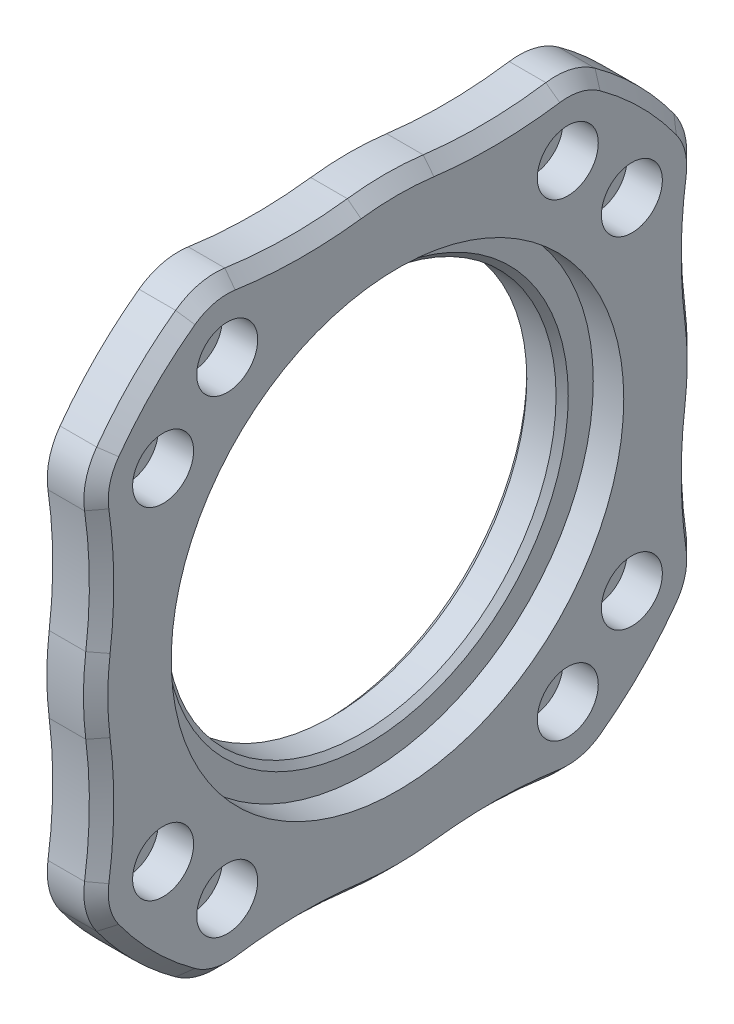
from build123d import *

# Parameters (mm, degrees)
SKETCH_1_R                     = 30
EXTRUDE_1_DEPTH                = 4
EXTRUDE_2_DEPTH                = 1.9
CHAMFER_1_SIZE                 = 1
SKETCH_5_R                     = 16
CUT_EXTRUDE_2_DEPTH            = 43.83468221
HOLE_WIZARD_M2_5_1_D           = 2.7
HOLE_WIZARD_M2_5_1_CBORE_D     = 5
HOLE_WIZARD_M2_5_1_CBORE_DEPTH = 2.9
SKETCH_8_OUTSIDE_W             = 79.012
SKETCH_8_OUTSIDE_H             = 79.012
CUT_EXTRUDE_3_DEPTH            = 43.83468221
CHAMFER_2_SIZE                 = 1
SKETCH_9_R                     = 18.55
CUT_EXTRUDE_4_DEPTH            = 2.5
CHAMFER_3_SIZE                 = 0.5


with BuildPart() as part:
    # 草图1 → 凸台-拉伸1 (new body)
    with BuildSketch(Plane.YZ):
        with Locations(Location((0, 0, 0), (0, 0, 270))):
            Circle(SKETCH_1_R)
    extrude(amount=EXTRUDE_1_DEPTH)

    # 草图2 → 凸台-拉伸2 (add)
    with BuildSketch(Plane(origin=(0, 0, 0), x_dir=(0, -1, 0), z_dir=(-1, 0, 0))):
        with BuildLine():
            ThreePointArc((-15.429362873, -21.236696102), (-14.556584324, -21.641903091), (-13.595407183, -21.687439927))
            ThreePointArc((-13.595407183, -21.687439927), (-8.168716079, -21.262073185), (-2.734521388, -21.577416267))
            ThreePointArc((-2.734521388, -21.577416267), (0, -21.75), (2.734521388, -21.577416267))
            ThreePointArc((2.734521388, -21.577416267), (8.168716079, -21.262073185), (13.595407183, -21.687439927))
            ThreePointArc((13.595407183, -21.687439927), (14.556584324, -21.641903091), (15.429362873, -21.236696102))
            ThreePointArc((15.429362873, -21.236696102), (18.561553006, -18.561553006), (21.236696102, -15.429362873))
            ThreePointArc((21.236696102, -15.429362873), (21.641903091, -14.556584324), (21.687439927, -13.595407183))
            ThreePointArc((21.687439927, -13.595407183), (21.262073185, -8.168716079), (21.577416267, -2.734521388))
            ThreePointArc((21.577416267, -2.734521388), (21.75, 0), (21.577416267, 2.734521388))
            ThreePointArc((21.577416267, 2.734521388), (21.262073185, 8.168716079), (21.687439927, 13.595407183))
            ThreePointArc((21.687439927, 13.595407183), (21.641903091, 14.556584324), (21.236696102, 15.429362873))
            ThreePointArc((21.236696102, 15.429362873), (18.561553006, 18.561553006), (15.429362873, 21.236696102))
            ThreePointArc((15.429362873, 21.236696102), (14.556584324, 21.641903091), (13.595407183, 21.687439927))
            ThreePointArc((13.595407183, 21.687439927), (8.168716079, 21.262073185), (2.734521388, 21.577416267))
            ThreePointArc((2.734521388, 21.577416267), (0, 21.75), (-2.734521388, 21.577416267))
            ThreePointArc((-2.734521388, 21.577416267), (-8.168716079, 21.262073185), (-13.595407183, 21.687439927))
            ThreePointArc((-13.595407183, 21.687439927), (-14.556584324, 21.641903091), (-15.429362873, 21.236696102))
            ThreePointArc((-15.429362873, 21.236696102), (-18.561553006, 18.561553006), (-21.236696102, 15.429362873))
            ThreePointArc((-21.236696102, 15.429362873), (-21.641903091, 14.556584324), (-21.687439927, 13.595407183))
            ThreePointArc((-21.687439927, 13.595407183), (-21.262073185, 8.168716079), (-21.577416267, 2.734521388))
            ThreePointArc((-21.577416267, 2.734521388), (-21.75, 0), (-21.577416267, -2.734521388))
            ThreePointArc((-21.577416267, -2.734521388), (-21.262073185, -8.168716079), (-21.687439927, -13.595407183))
            ThreePointArc((-21.687439927, -13.595407183), (-21.641903091, -14.556584324), (-21.236696102, -15.429362873))
            ThreePointArc((-21.236696102, -15.429362873), (-18.561553006, -18.561553006), (-15.429362873, -21.236696102))
        make_face()
    extrude(amount=EXTRUDE_2_DEPTH)

    # 倒角1
    chamfer_1_edges = [part.edges().sort_by_distance(p)[0] for p in [
        (0, 21.641903091, -14.556584324),
        (0, 18.561553006, -18.561553006),
        (0, 14.556584324, -21.641903091),
        (0, 8.168716079, -21.262073185),
        (0, 0, -21.75),
        (0, -8.168716079, -21.262073185),
        (0, -14.556584324, -21.641903091),
        (0, -18.561553006, -18.561553006),
        (0, -21.641903091, -14.556584324),
        (0, -21.262073185, -8.168716079),
        (0, -21.75, 0),
        (0, -21.262073185, 8.168716079),
        (0, -21.641903091, 14.556584324),
        (0, -18.561553006, 18.561553006),
        (0, -14.556584324, 21.641903091),
        (0, -8.168716079, 21.262073185),
        (0, 0, 21.75),
        (0, 8.168716079, 21.262073185),
        (0, 14.556584324, 21.641903091),
        (0, 18.561553006, 18.561553006),
        (0, 21.641903091, 14.556584324),
        (0, 21.262073185, 8.168716079),
        (0, 21.75, 0),
        (0, 21.262073185, -8.168716079),
    ]]
    chamfer(chamfer_1_edges, length=CHAMFER_1_SIZE)

    # 草图5 → 切除-拉伸2 (cut, through all)
    with BuildSketch(Plane.YZ.offset(4)):
        with Locations(Location((0, 0, 0), (0, 0, 270))):
            Circle(SKETCH_5_R)
    extrude(amount=-CUT_EXTRUDE_2_DEPTH, mode=Mode.SUBTRACT)

    # M2.5 六角圆柱头螺钉的柱形沉头孔1 (through all)
    with Locations(Plane.YZ.offset(4)):
        with Locations((-13.959899742, 19.214153616), (13.959899742, 19.214153616), (19.214153616, 13.959899742), (19.214153616, -13.959899742), (13.959899742, -19.214153616), (-13.959899742, -19.214153616), (-19.214153616, -13.959899742), (-19.214153616, 13.959899742)):
            CounterBoreHole(HOLE_WIZARD_M2_5_1_D / 2, HOLE_WIZARD_M2_5_1_CBORE_D / 2, HOLE_WIZARD_M2_5_1_CBORE_DEPTH)

    # 草图8 outside → 切除-拉伸3 (cut, through all)
    with BuildSketch(Plane(origin=(4, 0, 0), x_dir=(0, 0, -1), z_dir=(1, 0, 0))):
        Rectangle(SKETCH_8_OUTSIDE_W, SKETCH_8_OUTSIDE_H)
        with BuildLine():
            ThreePointArc((-3.111696751, 24.553611615), (-8.138326841, 24.261919263), (-13.158016112, 24.6553835))
            ThreePointArc((-13.158016112, 24.6553835), (-15.272605822, 24.55520246), (-17.19271863, 23.663747085))
            ThreePointArc((-17.19271863, 23.663747085), (-20.68287335, 20.68287335), (-23.663747085, 17.19271863))
            ThreePointArc((-23.663747085, 17.19271863), (-24.55520246, 15.272605822), (-24.6553835, 13.158016112))
            ThreePointArc((-24.6553835, 13.158016112), (-24.261919263, 8.138326841), (-24.553611615, 3.111696751))
            ThreePointArc((-24.553611615, 3.111696751), (-24.75, 0), (-24.553611615, -3.111696751))
            ThreePointArc((-24.553611615, -3.111696751), (-24.261919263, -8.138326841), (-24.6553835, -13.158016112))
            ThreePointArc((-24.6553835, -13.158016112), (-24.55520246, -15.272605822), (-23.663747085, -17.19271863))
            ThreePointArc((-23.663747085, -17.19271863), (-20.68287335, -20.68287335), (-17.19271863, -23.663747085))
            ThreePointArc((-17.19271863, -23.663747085), (-15.272605822, -24.55520246), (-13.158016112, -24.6553835))
            ThreePointArc((-13.158016112, -24.6553835), (-8.138326841, -24.261919263), (-3.111696751, -24.553611615))
            ThreePointArc((-3.111696751, -24.553611615), (0, -24.75), (3.111696751, -24.553611615))
            ThreePointArc((3.111696751, -24.553611615), (8.138326841, -24.261919263), (13.158016112, -24.6553835))
            ThreePointArc((13.158016112, -24.6553835), (15.272605822, -24.55520246), (17.19271863, -23.663747085))
            ThreePointArc((17.19271863, -23.663747085), (20.68287335, -20.68287335), (23.663747085, -17.19271863))
            ThreePointArc((23.663747085, -17.19271863), (24.55520246, -15.272605822), (24.6553835, -13.158016112))
            ThreePointArc((24.6553835, -13.158016112), (24.261919263, -8.138326841), (24.553611615, -3.111696751))
            ThreePointArc((24.553611615, -3.111696751), (24.75, 0), (24.553611615, 3.111696751))
            ThreePointArc((24.553611615, 3.111696751), (24.261919263, 8.138326841), (24.6553835, 13.158016112))
            ThreePointArc((24.6553835, 13.158016112), (24.55520246, 15.272605822), (23.663747085, 17.19271863))
            ThreePointArc((23.663747085, 17.19271863), (20.68287335, 20.68287335), (17.19271863, 23.663747085))
            ThreePointArc((17.19271863, 23.663747085), (15.272605822, 24.55520246), (13.158016112, 24.6553835))
            ThreePointArc((13.158016112, 24.6553835), (8.138326841, 24.261919263), (3.111696751, 24.553611615))
            ThreePointArc((3.111696751, 24.553611615), (0, 24.75), (-3.111696751, 24.553611615))
        make_face(mode=Mode.SUBTRACT)
    extrude(amount=-CUT_EXTRUDE_3_DEPTH, mode=Mode.SUBTRACT)

    # 倒角2
    chamfer_2_edges = [part.edges().sort_by_distance(p)[0] for p in [
        (4, 24.75, 0),
        (4, 24.261919263, -8.138326841),
        (4, 24.55520246, -15.272605822),
        (4, 20.68287335, -20.68287335),
        (4, 15.272605822, -24.55520246),
        (4, 8.138326841, -24.261919263),
        (4, 0, -24.75),
        (4, -8.138326841, -24.261919263),
        (4, -15.272605822, -24.55520246),
        (4, -20.68287335, -20.68287335),
        (4, -24.55520246, -15.272605822),
        (4, -24.261919263, -8.138326841),
        (4, -24.75, 0),
        (4, -24.261919263, 8.138326841),
        (4, -24.55520246, 15.272605822),
        (4, -20.68287335, 20.68287335),
        (4, -15.272605822, 24.55520246),
        (4, -8.138326841, 24.261919263),
        (4, 0, 24.75),
        (4, 8.138326841, 24.261919263),
        (4, 15.272605822, 24.55520246),
        (4, 20.68287335, 20.68287335),
        (4, 24.55520246, 15.272605822),
        (4, 24.261919263, 8.138326841),
    ]]
    chamfer(chamfer_2_edges, length=CHAMFER_2_SIZE)

    # 草图9 → 切除-拉伸4 (cut)
    with BuildSketch(Plane(origin=(4, 0, 0), x_dir=(0, 0, -1), z_dir=(1, 0, 0))):
        Circle(SKETCH_9_R)
    extrude(amount=-CUT_EXTRUDE_4_DEPTH, mode=Mode.SUBTRACT)

    # 倒角3
    chamfer_3_edges = [part.edges().sort_by_distance(p)[0] for p in [
        (-1.9, 0, 16),
        (1.5, 0, 16),
    ]]
    chamfer(chamfer_3_edges, length=CHAMFER_3_SIZE)


solid = part.part
